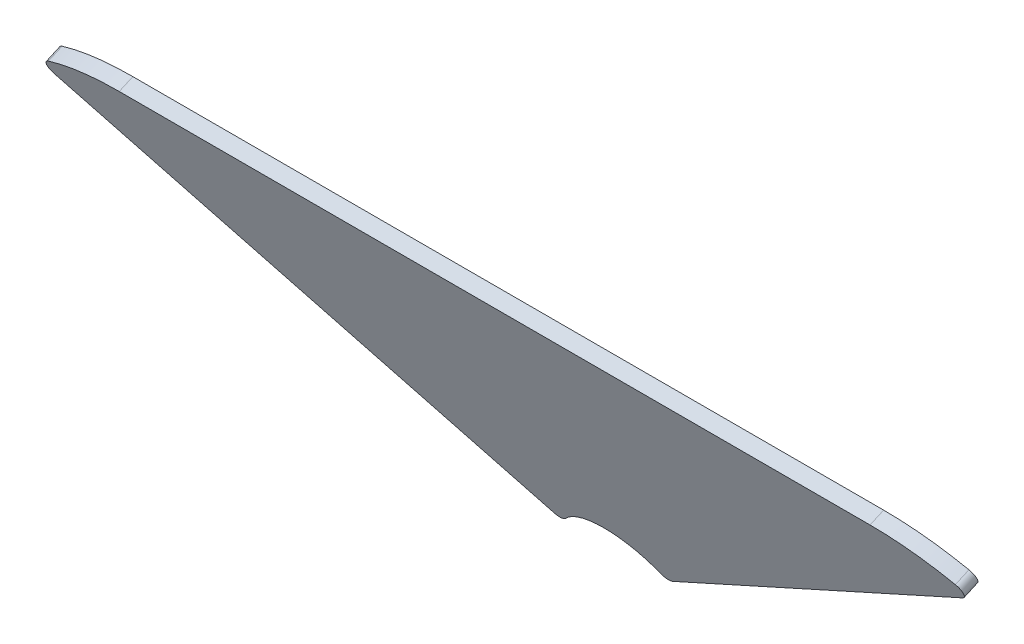
from build123d import *

# Parameters (mm, degrees)
BOSS_EXTRUDE1_DEPTH = 6.35
FILLET1_R           = 3.81


with BuildPart() as part:
    # Sketch3 → Boss-Extrude1 (new body)
    with BuildSketch(Plane(origin=(809.076030053, 943.560396052, 1278.390464274), x_dir=(-1, 0, 0), z_dir=(0, 0.4075747752498649, -0.913171836282757))):
        with BuildLine():
            Line((137.874265639, -126.392405854), (-26.505638525, -18.937567822))
            Line((-26.505638525, -18.937567822), (-39.07644953, -10.720052017))
            ThreePointArc((-39.07644953, -10.720052017), (-20.260111199, -2.728624711), (0, 0))
            Line((0, 0), (320.198396744, 0))
            ThreePointArc((320.198396744, 0), (340.458416927, -2.728663039), (359.274618149, -10.720195518))
            Line((359.274618149, -10.720195518), (346.703910708, -18.937649247))
            Line((346.703910708, -18.937649247), (182.324265639, -126.392391447))
            ThreePointArc((182.324265639, -126.392391447), (160.099261742, -114.368537545), (137.874265639, -126.392405854))
        make_face()
    extrude(amount=BOSS_EXTRUDE1_DEPTH)

    # Fillet1
    fillet1_edges = [part.edges().sort_by_distance(p)[0] for p in [
        (671.201764414, 829.436460617, 1223.976787284),
        (848.152479583, 935.065196378, 1271.121920902),
        (449.801411904, 935.065065337, 1271.121862415),
        (626.751764414, 829.436473773, 1223.976793156),
    ]]
    fillet(fillet1_edges, radius=FILLET1_R)


solid = part.part
